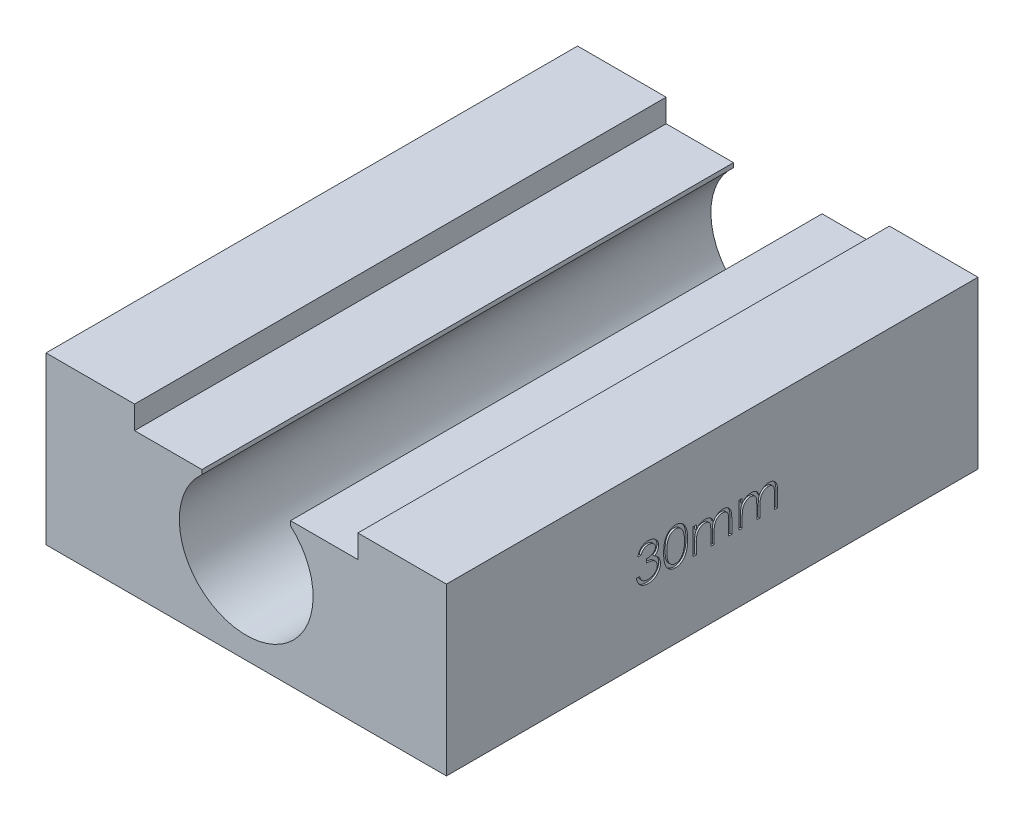
from build123d import *

# Parameters (mm, degrees)
BOSS_EXTRUDE1_DEPTH = 120
CUT_EXTRUDE1_DEPTH  = 0.4


with BuildPart() as part:
    # Sketch1 → Boss-Extrude1 (new body)
    with BuildSketch(Plane.XY):
        with BuildLine():
            Line((-25.2, 17.514150432), (-45.2, 17.514150432))
            Line((-45.2, 17.514150432), (-45.2, -20))
            Line((-45.2, -20), (45.2, -20))
            Line((45.2, -20), (45.2, 17.514150432))
            Line((45.2, 17.514150432), (25.2, 17.514150432))
            Line((25.2, 17.514150432), (25.2, 12.314150432))
            Line((25.2, 12.314150432), (10, 12.314150432))
            Line((10, 12.314150432), (10, 11.314150432))
            ThreePointArc((10, 11.314150432), (13.766081505, 6.205239721), (15.1, 0))
            ThreePointArc((15.1, 0), (-6.205239721, -13.766081505), (-10, 11.314150432))
            Line((-10, 11.314150432), (-10, 12.314150432))
            Line((-10, 12.314150432), (-25.2, 12.314150432))
            Line((-25.2, 12.314150432), (-25.2, 17.514150432))
        make_face()
    extrude(amount=BOSS_EXTRUDE1_DEPTH)

    # Sketch2 → Cut-Extrude1 (cut)
    # profile 1 of 4: a face of its own
    with BuildSketch(Plane(origin=(45.2, 0, 0), x_dir=(0, 0, -1), z_dir=(1, 0, 0))):
        with BuildLine():
            Line((-76.09656967, 1.200595483), (-76.814518387, 1.200595483))
            add(Edge.make_bspline(
                [(-76.814518387, 1.200595483), (-76.795067986, 1.281126875), (-76.757044042, 1.438559159), (-76.677735302, 1.663490041), (-76.591337005, 1.876343805), (-76.48759048, 2.07313483), (-76.374427613, 2.257818036), (-76.244775678, 2.426204607), (-76.104616313, 2.582577099), (-75.949587857, 2.721350213), (-75.787008059, 2.847013595), (-75.614586071, 2.954156583), (-75.435790885, 3.046326075), (-75.249383724, 3.122258034), (-75.054809618, 3.179459231), (-74.853827621, 3.2209605), (-74.64591105, 3.247911619), (-74.5047737, 3.250541934), (-74.433108131, 3.251877534)],
                knots=[0, 0, 0, 0, 1.162005537, 2.271625781, 3.343758855, 4.383309926, 5.390229558, 6.379919256, 7.361854164, 8.333198761, 9.295911338, 10.242430842, 11.177959212, 12.116337295, 13.062827104, 14.020064771, 14.994644689, 16, 16, 16, 16], degree=3))
            add(Edge.make_bspline(
                [(-74.433108131, 3.251877534), (-74.328690435, 3.248725008), (-74.122132696, 3.242488721), (-73.818674303, 3.185541438), (-73.526041573, 3.09542685), (-73.247437578, 2.970915473), (-72.988652589, 2.817344472), (-72.758398448, 2.63456793), (-72.559796138, 2.426112384), (-72.393180417, 2.195866523), (-72.262723277, 1.949796787), (-72.166525852, 1.696539285), (-72.107962009, 1.436694779), (-72.100372165, 1.26124957), (-72.09656967, 1.173351893)],
                knots=[0, 0, 0, 0, 1.083050992, 2.142477498, 3.193116406, 4.255571735, 5.30263384, 6.308962982, 7.297363603, 8.282367274, 9.249857812, 10.179914175, 11.08814088, 12, 12, 12, 12], degree=3))
            add(Edge.make_bspline(
                [(-72.09656967, 1.173351893), (-72.099229306, 1.088764934), (-72.104433802, 0.923241381), (-72.148625129, 0.681592245), (-72.22299373, 0.453840015), (-72.32601033, 0.239025931), (-72.459362445, 0.038512011), (-72.620900038, -0.148152882), (-72.811763265, -0.321796672), (-72.956400838, -0.421269753), (-73.030864541, -0.47248144)],
                knots=[0, 0, 0, 0, 1.024540389, 2.004866551, 2.965041327, 3.920577974, 4.882998113, 5.874504559, 6.905732034, 8, 8, 8, 8], degree=3))
            add(Edge.make_bspline(
                [(-73.030864541, -0.47248144), (-72.945763388, -0.513574403), (-72.77715339, -0.594991449), (-72.547323608, -0.754661752), (-72.338688464, -0.939019118), (-72.222337107, -1.082888039), (-72.163877362, -1.155173748)],
                knots=[0, 0, 0, 0, 1.015518401, 2.012035669, 3.001164323, 4, 4, 4, 4], degree=3))
            add(Edge.make_bspline(
                [(-72.163877362, -1.155173748), (-72.125382865, -1.20787718), (-72.049024245, -1.312420989), (-71.954771597, -1.480504248), (-71.86926505, -1.65045051), (-71.802635977, -1.826814866), (-71.751038567, -2.007553183), (-71.714156208, -2.192975803), (-71.691243886, -2.38323414), (-71.687962624, -2.51194838), (-71.686313259, -2.576648107)],
                knots=[0, 0, 0, 0, 1.025084078, 2.033381695, 3.024893161, 4.013698104, 4.991890475, 5.976764909, 6.982997093, 8, 8, 8, 8], degree=3))
            add(Edge.make_bspline(
                [(-71.686313259, -2.576648107), (-71.690415004, -2.688670326), (-71.698599192, -2.912187588), (-71.771751362, -3.242415523), (-71.885153055, -3.565216671), (-72.04619748, -3.873959161), (-72.242466071, -4.162828603), (-72.475968527, -4.421288738), (-72.744051746, -4.643456976), (-73.043036086, -4.829080355), (-73.366960951, -4.977464177), (-73.713419447, -5.080452618), (-74.077419571, -5.147529188), (-74.327036251, -5.154722032), (-74.453941464, -5.158378876)],
                knots=[0, 0, 0, 0, 0.955779014, 1.907060117, 2.875433937, 3.871313158, 4.872415639, 5.851225146, 6.836215519, 7.83643374, 8.849228613, 9.86973379, 10.916971861, 12, 12, 12, 12], degree=3))
            add(Edge.make_bspline(
                [(-74.453941464, -5.158378876), (-74.539471294, -5.156394388), (-74.707765477, -5.152489579), (-74.955179187, -5.125795633), (-75.191343071, -5.077041336), (-75.416576438, -5.01143378), (-75.631079378, -4.928252656), (-75.834197333, -4.82466706), (-76.027179947, -4.702812198), (-76.208206121, -4.561249712), (-76.377254276, -4.402892364), (-76.529831931, -4.224928913), (-76.668482886, -4.030649132), (-76.789494632, -3.817796432), (-76.898379095, -3.589121559), (-76.987935567, -3.341696419), (-77.066759724, -3.077732941), (-77.103407643, -2.89378382), (-77.122210695, -2.799404517)],
                knots=[0, 0, 0, 0, 1.048658725, 2.063410685, 3.046034179, 4.001477787, 4.936774919, 5.862367409, 6.792675028, 7.730719943, 8.675894397, 9.627829632, 10.600096036, 11.597688215, 12.626045268, 13.701542398, 14.82072376, 16, 16, 16, 16], degree=3))
            Line((-77.122210695, -2.799404517), (-76.404261977, -2.799404517))
            add(Edge.make_bspline(
                [(-76.404261977, -2.799404517), (-76.385557311, -2.861002261), (-76.349175111, -2.980815225), (-76.287245287, -3.15325021), (-76.216689236, -3.31132576), (-76.140998816, -3.456201467), (-76.061505226, -3.589304101), (-75.972556825, -3.707114088), (-75.880741636, -3.814805979), (-75.811531686, -3.875479377), (-75.777659413, -3.905173748)],
                knots=[0, 0, 0, 0, 1.198163088, 2.33053128, 3.407730985, 4.417276592, 5.372219308, 6.28897303, 7.162600585, 8, 8, 8, 8], degree=3))
            add(Edge.make_bspline(
                [(-75.777659413, -3.905173748), (-75.732867238, -3.939707082), (-75.643421152, -4.008667155), (-75.497665195, -4.096670877), (-75.344374027, -4.172924649), (-75.1802262, -4.231173097), (-75.008763867, -4.280493464), (-74.827215604, -4.312768937), (-74.637183108, -4.334913328), (-74.50742822, -4.336867457), (-74.441120952, -4.337866055)],
                knots=[0, 0, 0, 0, 0.946170439, 1.889420265, 2.845303464, 3.807233317, 4.801018734, 5.828864929, 6.890507805, 8, 8, 8, 8], degree=3))
            add(Edge.make_bspline(
                [(-74.441120952, -4.337866055), (-74.366255803, -4.336458272), (-74.219863467, -4.333705473), (-74.00625236, -4.308389572), (-73.803035337, -4.271520055), (-73.612468649, -4.214576094), (-73.432056061, -4.144219863), (-73.264326576, -4.05588065), (-73.107078334, -3.952235572), (-72.962325407, -3.834431781), (-72.832164247, -3.705468364), (-72.717559645, -3.570581344), (-72.620131847, -3.430339448), (-72.541540812, -3.2839666), (-72.479482411, -3.132068934), (-72.437235095, -2.974220181), (-72.407860204, -2.811712144), (-72.405467947, -2.701245929), (-72.404261977, -2.645558363)],
                knots=[0, 0, 0, 0, 1.217147791, 2.380027433, 3.494444702, 4.572153297, 5.609568379, 6.639424714, 7.649109417, 8.668170816, 9.669597737, 10.625200337, 11.543417969, 12.441394052, 13.322311151, 14.205496177, 15.095365482, 16, 16, 16, 16], degree=3))
            add(Edge.make_bspline(
                [(-72.404261977, -2.645558363), (-72.407759809, -2.57101816), (-72.414738069, -2.422308655), (-72.468014822, -2.203525628), (-72.555646511, -1.992729257), (-72.678326537, -1.793516023), (-72.827665345, -1.608885391), (-73.002213704, -1.444150573), (-73.203421083, -1.308218937), (-73.388609355, -1.214302008), (-73.552643999, -1.150217265), (-73.69302202, -1.107531632), (-73.850179971, -1.071386133), (-74.02221734, -1.037758084), (-74.210430406, -1.009137859), (-74.414614264, -0.985270852), (-74.634810291, -0.966173615), (-74.787247241, -0.957645398), (-74.865800439, -0.953250671)],
                knots=[0, 0, 0, 0, 1.07054697, 2.135767047, 3.216561865, 4.33974944, 5.486079747, 6.621378074, 7.775625952, 8.963672916, 9.598146892, 10.304877434, 11.070270905, 11.915000392, 12.823868403, 13.805723172, 14.86925407, 16, 16, 16, 16], degree=3))
            Line((-74.865800439, -0.953250671), (-74.865800439, -0.13273785))
            add(Edge.make_bspline(
                [(-74.865800439, -0.13273785), (-74.766826346, -0.131058299), (-74.572960411, -0.12776847), (-74.289773428, -0.087978732), (-74.018977286, -0.032937297), (-73.766573305, 0.051371714), (-73.536519103, 0.149292393), (-73.336931441, 0.2632403), (-73.170606533, 0.389902584), (-73.038352655, 0.531234263), (-72.938857275, 0.682811514), (-72.86611031, 0.840792446), (-72.823138135, 1.006561728), (-72.817401754, 1.119692398), (-72.814518387, 1.176557022)],
                knots=[0, 0, 0, 0, 1.321986639, 2.589447074, 3.816329219, 5.01088745, 6.139805852, 7.153945165, 8.075214402, 8.924034688, 9.728124013, 10.488707548, 11.240355623, 12, 12, 12, 12], degree=3))
            add(Edge.make_bspline(
                [(-72.814518387, 1.176557022), (-72.815465613, 1.218334725), (-72.817350072, 1.301449484), (-72.841115278, 1.422878212), (-72.876827372, 1.54059466), (-72.925923896, 1.654098226), (-72.991638636, 1.76260171), (-73.070280891, 1.867030164), (-73.163922263, 1.966787373), (-73.271226142, 2.059770961), (-73.386453125, 2.14838636), (-73.512738325, 2.223617531), (-73.646274038, 2.287949101), (-73.787208107, 2.340999392), (-73.93599789, 2.380906336), (-74.091944308, 2.409559688), (-74.255344727, 2.427474327), (-74.366822972, 2.430053564), (-74.423492746, 2.431364714)],
                knots=[0, 0, 0, 0, 0.884392785, 1.759457502, 2.611959086, 3.489218968, 4.37281399, 5.2945488, 6.255912374, 7.266815255, 8.301784654, 9.332968512, 10.37626691, 11.440494194, 12.520033166, 13.637162961, 14.798855837, 16, 16, 16, 16], degree=3))
            add(Edge.make_bspline(
                [(-74.423492746, 2.431364714), (-74.514582273, 2.428184458), (-74.692501305, 2.421972678), (-74.948992544, 2.36756579), (-75.187436736, 2.280758742), (-75.369696545, 2.177140412), (-75.504285286, 2.074853706), (-75.600461145, 1.985522537), (-75.694908026, 1.886247512), (-75.78141243, 1.770914083), (-75.868895805, 1.647332848), (-75.948540517, 1.509221576), (-76.025934099, 1.36018296), (-76.072568499, 1.25482151), (-76.09656967, 1.200595483)],
                knots=[0, 0, 0, 0, 1.472543308, 2.876219568, 4.221790263, 5.565193594, 6.249813518, 6.953379497, 7.687249741, 8.463570142, 9.283606569, 10.136032583, 11.040678096, 12, 12, 12, 12], degree=3))
        make_face()
    # profile 2 of 4: a face of its own
    with BuildSketch(Plane(origin=(45.2, 0, 0), x_dir=(0, 0, -1), z_dir=(1, 0, 0))):
        with BuildLine():
            add(Edge.make_bspline(
                [(-70.968364541, -0.956455799), (-70.967614786, -0.828233198), (-70.966158374, -0.579158949), (-70.949956269, -0.216222624), (-70.923041201, 0.124258037), (-70.886155777, 0.44229933), (-70.841268965, 0.737983364), (-70.781347853, 1.010519951), (-70.713204304, 1.261170481), (-70.634227285, 1.490752306), (-70.545112339, 1.702358484), (-70.448119743, 1.899901801), (-70.339400213, 2.083083361), (-70.225167269, 2.254826882), (-70.10079682, 2.412321042), (-69.969828156, 2.557789984), (-69.827149581, 2.6878717), (-69.677611277, 2.806377534), (-69.519859358, 2.91026204), (-69.358390407, 3.001765443), (-69.192093022, 3.079936568), (-69.020513176, 3.141400422), (-68.845193043, 3.192168071), (-68.665519748, 3.226885666), (-68.48119663, 3.248730028), (-68.356781922, 3.250818412), (-68.293685054, 3.251877534)],
                knots=[0, 0, 0, 0, 1.646270934, 3.197905019, 4.663502075, 6.030701355, 7.308322542, 8.50163776, 9.611534131, 10.641858119, 11.616356847, 12.558055219, 13.465016945, 14.349605745, 15.204443733, 16.039544428, 16.859896111, 17.680448484, 18.487036065, 19.28249412, 20.06191084, 20.843045899, 21.620316918, 22.403196591, 23.190181807, 24, 24, 24, 24], degree=3))
            add(Edge.make_bspline(
                [(-68.293685054, 3.251877534), (-68.230061103, 3.250762528), (-68.103533083, 3.248545132), (-67.916469368, 3.227233263), (-67.733727239, 3.191870696), (-67.556085779, 3.141765611), (-67.38208581, 3.079604065), (-67.213088306, 3.001690654), (-67.048043548, 2.9109961), (-66.88957432, 2.804427238), (-66.735940913, 2.685610607), (-66.590916998, 2.551295935), (-66.454489373, 2.402839434), (-66.324945818, 2.241829459), (-66.205961596, 2.065177837), (-66.092650893, 1.875957014), (-65.991229097, 1.670857895), (-65.893549839, 1.45330254), (-65.809236727, 1.21727132), (-65.733199595, 0.964094724), (-65.671761952, 0.690782297), (-65.620586473, 0.398768022), (-65.580940996, 0.086979489), (-65.552066386, -0.243914946), (-65.53681362, -0.594132982), (-65.53394116, -0.833579495), (-65.532467105, -0.956455799)],
                knots=[0, 0, 0, 0, 0.810914788, 1.612654377, 2.396697861, 3.181598691, 3.963628158, 4.749916497, 5.551656086, 6.361998678, 7.18212741, 8.025565596, 8.878627764, 9.750805457, 10.657531673, 11.591944965, 12.560506719, 13.57287815, 14.630710178, 15.753379473, 16.941251878, 18.199788006, 19.531962791, 20.947069417, 22.433333509, 24, 24, 24, 24], degree=3))
            add(Edge.make_bspline(
                [(-65.532467105, -0.956455799), (-65.533956442, -1.07879616), (-65.536858352, -1.317171364), (-65.551895396, -1.665813593), (-65.581515125, -1.994951978), (-65.618566526, -2.305375892), (-65.669883013, -2.595793307), (-65.732980536, -2.867209189), (-65.803038417, -3.120795639), (-65.889517946, -3.354475208), (-65.984170998, -3.571507717), (-66.087154304, -3.774175485), (-66.197485335, -3.964269868), (-66.317688181, -4.14026929), (-66.445810268, -4.303420506), (-66.584593785, -4.450843643), (-66.730126551, -4.586090894), (-66.884212073, -4.706437471), (-67.045152762, -4.811774167), (-67.209630652, -4.905977254), (-67.3805641, -4.981937699), (-67.55407942, -5.04716065), (-67.732658543, -5.096990255), (-67.916078864, -5.131444781), (-68.103407403, -5.155609006), (-68.230039552, -5.157452389), (-68.293685054, -5.158378876)],
                knots=[0, 0, 0, 0, 1.561518951, 3.042555995, 4.452378317, 5.7783523, 7.031515105, 8.214008947, 9.334062868, 10.386615937, 11.391082383, 12.354592575, 13.286541444, 14.194233754, 15.072674879, 15.931287219, 16.775624067, 17.606195743, 18.42308326, 19.229000347, 20.022332153, 20.807536673, 21.593273796, 22.3848459, 23.188221202, 24, 24, 24, 24], degree=3))
            add(Edge.make_bspline(
                [(-68.293685054, -5.158378876), (-68.356780172, -5.15731292), (-68.481191428, -5.155211065), (-68.665539829, -5.133465393), (-68.844471129, -5.098504242), (-69.018868281, -5.049552005), (-69.18962603, -4.989632379), (-69.354417542, -4.911566816), (-69.515075105, -4.821660373), (-69.67117009, -4.719270838), (-69.819769315, -4.601964134), (-69.961708984, -4.472217188), (-70.093423314, -4.326792248), (-70.216015532, -4.167985567), (-70.332527734, -3.997258156), (-70.439703444, -3.812279017), (-70.538836825, -3.613781622), (-70.629450518, -3.40048354), (-70.70979032, -3.169272277), (-70.78075651, -2.917502726), (-70.83678887, -2.6429527), (-70.884749911, -2.34782729), (-70.923434215, -2.030858306), (-70.949844102, -1.69187367), (-70.966167107, -1.331084621), (-70.967618697, -1.083610851), (-70.968364541, -0.956455799)],
                knots=[0, 0, 0, 0, 0.810891512, 1.598919785, 2.382837074, 3.152667961, 3.926044502, 4.706494248, 5.493654104, 6.291793342, 7.103789334, 7.925228297, 8.761435821, 9.622817696, 10.50288917, 11.416980706, 12.369136599, 13.353924996, 14.394355917, 15.514179734, 16.714354668, 17.994756427, 19.357759367, 20.818452758, 22.365282078, 24, 24, 24, 24], degree=3))
        make_face()
        with BuildLine():
            add(Edge.make_bspline(
                [(-70.250415823, -0.953250671), (-70.250142802, -1.060104839), (-70.24961292, -1.267487799), (-70.235770175, -1.568843824), (-70.216912502, -1.849918861), (-70.192589537, -2.111069802), (-70.156468512, -2.351412688), (-70.115995854, -2.572600535), (-70.066743078, -2.773462791), (-70.008468751, -2.955377787), (-69.942093673, -3.1214328), (-69.869623127, -3.275949864), (-69.791770046, -3.42075429), (-69.704640559, -3.554545395), (-69.609748986, -3.677759484), (-69.50923868, -3.792577386), (-69.399358487, -3.894970487), (-69.247349933, -4.017774727), (-69.046672277, -4.144675604), (-68.793825522, -4.255180952), (-68.53401192, -4.324626567), (-68.357666205, -4.333458009), (-68.269646593, -4.337866055)],
                knots=[0, 0, 0, 0, 1.459021318, 2.831673884, 4.118529203, 5.306027144, 6.411944654, 7.436330062, 8.375795394, 9.233974572, 10.042671642, 10.816086306, 11.563610507, 12.285937304, 12.993564865, 13.685989202, 14.367179055, 15.041617293, 16.353048772, 17.594441528, 18.799311195, 20, 20, 20, 20], degree=3))
            add(Edge.make_bspline(
                [(-68.269646593, -4.337866055), (-68.181057629, -4.334213985), (-68.004062604, -4.326917384), (-67.745471073, -4.25652027), (-67.494430455, -4.15030418), (-67.297694592, -4.024709882), (-67.148020207, -3.905102272), (-67.040781372, -3.803125933), (-66.942353833, -3.688941093), (-66.849000519, -3.565742703), (-66.763379775, -3.431177024), (-66.685521174, -3.285891138), (-66.614473523, -3.129481589), (-66.573995703, -3.020293613), (-66.553300439, -2.964468619)],
                knots=[0, 0, 0, 0, 1.353760809, 2.704726607, 4.075137775, 5.516104923, 6.260822281, 7.007110065, 7.778089737, 8.566572457, 9.372053459, 10.217411131, 11.088608312, 12, 12, 12, 12], degree=3))
            add(Edge.make_bspline(
                [(-66.553300439, -2.964468619), (-66.529182112, -2.893086358), (-66.480211566, -2.748149754), (-66.41709894, -2.523318549), (-66.36739517, -2.287426517), (-66.322678905, -2.041883393), (-66.292157635, -1.784878362), (-66.267591204, -1.517206628), (-66.253121063, -1.238666371), (-66.251327346, -1.049420677), (-66.250415823, -0.953250671)],
                knots=[0, 0, 0, 0, 0.884706709, 1.796334032, 2.740027952, 3.714592787, 4.726048262, 5.777819803, 6.87074269, 8, 8, 8, 8], degree=3))
            add(Edge.make_bspline(
                [(-66.250415823, -0.953250671), (-66.251673399, -0.857096219), (-66.254133485, -0.668997557), (-66.263536886, -0.39352743), (-66.287819342, -0.131886833), (-66.314788756, 0.11705139), (-66.354553833, 0.351909225), (-66.39742882, 0.57465278), (-66.455031591, 0.782522551), (-66.516562505, 0.978773023), (-66.586986266, 1.161174519), (-66.664507945, 1.330577459), (-66.747300536, 1.487799687), (-66.837225657, 1.63240984), (-66.93321579, 1.765055652), (-67.037804474, 1.883077582), (-67.14684304, 1.990133509), (-67.299568036, 2.112333667), (-67.49950927, 2.236931829), (-67.748299321, 2.351596422), (-68.007203651, 2.417443948), (-68.182228689, 2.426727805), (-68.269646593, 2.431364714)],
                knots=[0, 0, 0, 0, 1.31362396, 2.569729283, 3.763502607, 4.902122613, 5.988968491, 7.01645872, 7.998833611, 8.933434873, 9.825090667, 10.667526885, 11.477055099, 12.250526234, 12.991942729, 13.710640831, 14.402115721, 15.076753259, 16.378508321, 17.609869233, 18.806226677, 20, 20, 20, 20], degree=3))
            add(Edge.make_bspline(
                [(-68.269646593, 2.431364714), (-68.358127946, 2.426721407), (-68.535251844, 2.417426335), (-68.79684717, 2.351841755), (-69.047599973, 2.237526405), (-69.247012487, 2.111920982), (-69.399843999, 1.992290556), (-69.507461584, 1.888550089), (-69.60836712, 1.775072937), (-69.701321863, 1.650725703), (-69.788383082, 1.517090577), (-69.868339682, 1.373116258), (-69.940379293, 1.21807314), (-70.006858233, 1.052092716), (-70.06531032, 0.870193414), (-70.113525093, 0.669578572), (-70.158066929, 0.449094248), (-70.189598972, 0.207449658), (-70.217630414, -0.053766692), (-70.235644923, -0.33554342), (-70.249659226, -0.637404861), (-70.250158573, -0.84586008), (-70.250415823, -0.953250671)],
                knots=[0, 0, 0, 0, 1.207732386, 2.417664972, 3.655092373, 4.956220595, 5.625982001, 6.301752483, 6.994047911, 7.697131622, 8.419323945, 9.170223765, 9.943494443, 10.752040957, 11.610060368, 12.549350801, 13.567764191, 14.679664412, 15.874934091, 17.154273443, 18.533957287, 20, 20, 20, 20], degree=3))
        make_face(mode=Mode.SUBTRACT)
    # profile 3 of 4: a face of its own
    with BuildSketch(Plane(origin=(45.2, 0, 0), x_dir=(0, 0, -1), z_dir=(1, 0, 0))):
        with BuildLine():
            Line((-64.301697875, 0.892903175), (-63.583749157, 0.892903175))
            Line((-63.583749157, 0.892903175), (-63.583749157, -0.123122466))
            add(Edge.make_bspline(
                [(-63.583749157, -0.123122466), (-63.519100128, -0.034236519), (-63.395226392, 0.136077477), (-63.192104901, 0.360512412), (-62.989188072, 0.550976766), (-62.843054628, 0.650960472), (-62.772851721, 0.698992919)],
                knots=[0, 0, 0, 0, 1.134379233, 2.173579362, 3.122582517, 4, 4, 4, 4], degree=3))
            add(Edge.make_bspline(
                [(-62.772851721, 0.698992919), (-62.677161064, 0.744719468), (-62.487451579, 0.83537367), (-62.187064779, 0.927336091), (-61.879694106, 0.983850608), (-61.672132474, 0.991579461), (-61.567723516, 0.995467278)],
                knots=[0, 0, 0, 0, 1.014936303, 2.012140481, 3.000054389, 4, 4, 4, 4], degree=3))
            add(Edge.make_bspline(
                [(-61.567723516, 0.995467278), (-61.497110952, 0.993078042), (-61.357372486, 0.988349872), (-61.150323137, 0.957584078), (-60.949503453, 0.904404254), (-60.756099957, 0.83033037), (-60.573881262, 0.740623657), (-60.406820238, 0.635367182), (-60.256822048, 0.517202438), (-60.123962502, 0.380793449), (-60.004490444, 0.222309795), (-59.894595938, 0.037477226), (-59.793052595, -0.177854571), (-59.736775318, -0.33412095), (-59.707146593, -0.416391696)],
                knots=[0, 0, 0, 0, 1.009824226, 1.998387844, 2.986035974, 3.974953746, 4.955485308, 5.885931332, 6.793869504, 7.679848016, 8.601185859, 9.625726857, 10.749998409, 12, 12, 12, 12], degree=3))
            add(Edge.make_bspline(
                [(-59.707146593, -0.416391696), (-59.67580659, -0.359878738), (-59.614133865, -0.248669172), (-59.510578123, -0.091278859), (-59.402080302, 0.055936666), (-59.287715747, 0.193094207), (-59.16788812, 0.319516448), (-59.04203349, 0.435621366), (-58.910868276, 0.541907569), (-58.728486013, 0.66607479), (-58.491200053, 0.797963205), (-58.19202722, 0.912313934), (-57.880826827, 0.98297937), (-57.669586374, 0.991277137), (-57.562915823, 0.995467278)],
                knots=[0, 0, 0, 0, 0.86119277, 1.694706429, 2.50939023, 3.298075842, 4.073795165, 4.829715201, 5.57930267, 6.321991688, 7.768977793, 9.186738141, 10.579381044, 12, 12, 12, 12], degree=3))
            add(Edge.make_bspline(
                [(-57.562915823, 0.995467278), (-57.464901051, 0.991770773), (-57.273076625, 0.984536354), (-56.993814304, 0.927728415), (-56.733375892, 0.830179508), (-56.492285432, 0.697074053), (-56.274777287, 0.529807348), (-56.085711437, 0.330792862), (-55.926236321, 0.101438295), (-55.822056573, -0.114314822), (-55.751393112, -0.304795583), (-55.707824577, -0.467095677), (-55.669333845, -0.645727798), (-55.637376713, -0.840905539), (-55.614020023, -1.053318358), (-55.59671553, -1.282618645), (-55.585003362, -1.528984615), (-55.584175768, -1.698962901), (-55.583749157, -1.786584004)],
                knots=[0, 0, 0, 0, 1.209669288, 2.367440248, 3.500751976, 4.631527125, 5.755587489, 6.87532382, 8.007944318, 9.190864318, 9.82315674, 10.514484317, 11.263564316, 12.079023757, 12.955305781, 13.901327259, 14.918167583, 16, 16, 16, 16], degree=3))
            Line((-55.583749157, -1.786584004), (-55.583749157, -4.953250671))
            Line((-55.583749157, -4.953250671), (-56.301697875, -4.953250671))
            Line((-56.301697875, -4.953250671), (-56.301697875, -1.783378876))
            add(Edge.make_bspline(
                [(-56.301697875, -1.783378876), (-56.301875893, -1.708588993), (-56.302218017, -1.564854211), (-56.308374889, -1.358562894), (-56.319975607, -1.170520935), (-56.333540495, -1.000984733), (-56.352383488, -0.849558931), (-56.376717047, -0.716547689), (-56.402494601, -0.600904691), (-56.445319723, -0.472708011), (-56.513772047, -0.331290387), (-56.618040573, -0.178779357), (-56.749400816, -0.046023242), (-56.901081173, 0.069218625), (-57.073763333, 0.162918376), (-57.2640827, 0.22983497), (-57.470857675, 0.271258692), (-57.613995477, 0.275386728), (-57.687915823, 0.27751856)],
                knots=[0, 0, 0, 0, 1.253487763, 2.409012846, 3.458416907, 4.410876679, 5.259312806, 6.014470957, 6.676830364, 7.243083969, 8.276244668, 9.299465089, 10.325150304, 11.392391894, 12.482080715, 13.603491619, 14.762376348, 16, 16, 16, 16], degree=3))
            add(Edge.make_bspline(
                [(-57.687915823, 0.27751856), (-57.778590005, 0.274281629), (-57.957796659, 0.267884222), (-58.219386342, 0.202572513), (-58.470748665, 0.104103368), (-58.704383255, -0.038599391), (-58.919303919, -0.209589937), (-59.10421724, -0.412903298), (-59.256976521, -0.64291456), (-59.360414181, -0.855821308), (-59.425761155, -1.047065751), (-59.468908391, -1.214145459), (-59.502470429, -1.404046185), (-59.533945924, -1.615491879), (-59.554489302, -1.849938005), (-59.573159867, -2.106300065), (-59.581893268, -2.385349115), (-59.583114888, -2.578781546), (-59.583749157, -2.679212209)],
                knots=[0, 0, 0, 0, 1.090531906, 2.155305635, 3.229839962, 4.33261226, 5.44038871, 6.529323825, 7.629011124, 8.757537029, 9.370236727, 10.061839251, 10.834451254, 11.692844982, 12.636905849, 13.66920014, 14.789842145, 16, 16, 16, 16], degree=3))
            Line((-59.583749157, -2.679212209), (-59.583749157, -4.953250671))
            Line((-59.583749157, -4.953250671), (-60.301697875, -4.953250671))
            Line((-60.301697875, -4.953250671), (-60.301697875, -1.98049426))
            add(Edge.make_bspline(
                [(-60.301697875, -1.98049426), (-60.301879431, -1.896623818), (-60.302228728, -1.735265515), (-60.308346024, -1.503874258), (-60.319972588, -1.293403217), (-60.333413842, -1.104097014), (-60.352751393, -0.936299691), (-60.374716563, -0.789111673), (-60.400656244, -0.662901956), (-60.443604552, -0.524471362), (-60.509237622, -0.371966396), (-60.614810793, -0.209358347), (-60.746485262, -0.067031267), (-60.900932978, 0.054474444), (-61.074660252, 0.154912115), (-61.266622311, 0.227277262), (-61.475090683, 0.269389924), (-61.618811154, 0.274757916), (-61.692723516, 0.27751856)],
                knots=[0, 0, 0, 0, 1.320475261, 2.540461679, 3.643808994, 4.639130445, 5.527981419, 6.302341397, 6.981980563, 7.553956391, 8.582137848, 9.585246428, 10.591171744, 11.620968678, 12.668337649, 13.738356861, 14.836885341, 16, 16, 16, 16], degree=3))
            add(Edge.make_bspline(
                [(-61.692723516, 0.27751856), (-61.779617713, 0.274020366), (-61.952794763, 0.267048589), (-62.207199265, 0.204295963), (-62.452880828, 0.106000935), (-62.68592014, -0.030364366), (-62.900032478, -0.199276546), (-63.087479947, -0.397939165), (-63.245062862, -0.623879813), (-63.349592725, -0.834541565), (-63.417017808, -1.020994764), (-63.461807145, -1.179511216), (-63.500297718, -1.355511784), (-63.528901196, -1.549539466), (-63.556513575, -1.760330539), (-63.569839996, -1.988935086), (-63.582803566, -2.235157001), (-63.583426228, -2.40515139), (-63.583749157, -2.493314773)],
                knots=[0, 0, 0, 0, 1.098833095, 2.189935336, 3.297829714, 4.440610912, 5.596351641, 6.740013378, 7.886572111, 9.072425424, 9.705826452, 10.395263256, 11.156850408, 11.985370555, 12.878090359, 13.847760091, 14.883794034, 16, 16, 16, 16], degree=3))
            Line((-63.583749157, -2.493314773), (-63.583749157, -4.953250671))
            Line((-63.583749157, -4.953250671), (-64.301697875, -4.953250671))
            Line((-64.301697875, -4.953250671), (-64.301697875, 0.892903175))
        make_face()
    # profile 4 of 4: a face of its own
    with BuildSketch(Plane(origin=(45.2, 0, 0), x_dir=(0, 0, -1), z_dir=(1, 0, 0))):
        with BuildLine():
            Line((-53.942723516, 0.892903175), (-53.224774798, 0.892903175))
            Line((-53.224774798, 0.892903175), (-53.224774798, -0.123122466))
            add(Edge.make_bspline(
                [(-53.224774798, -0.123122466), (-53.160125769, -0.034236519), (-53.036252033, 0.136077477), (-52.833130542, 0.360512412), (-52.630213713, 0.550976766), (-52.484080269, 0.650960472), (-52.413877362, 0.698992919)],
                knots=[0, 0, 0, 0, 1.134379233, 2.173579362, 3.122582517, 4, 4, 4, 4], degree=3))
            add(Edge.make_bspline(
                [(-52.413877362, 0.698992919), (-52.318186705, 0.744719468), (-52.12847722, 0.83537367), (-51.828090421, 0.927336091), (-51.520719747, 0.983850608), (-51.313158115, 0.991579461), (-51.208749157, 0.995467278)],
                knots=[0, 0, 0, 0, 1.014936303, 2.012140481, 3.000054389, 4, 4, 4, 4], degree=3))
            add(Edge.make_bspline(
                [(-51.208749157, 0.995467278), (-51.138136593, 0.993078042), (-50.998398127, 0.988349872), (-50.791348778, 0.957584078), (-50.590529094, 0.904404254), (-50.397125598, 0.83033037), (-50.214906903, 0.740623657), (-50.047845879, 0.635367182), (-49.897847689, 0.517202438), (-49.764988143, 0.380793449), (-49.645516085, 0.222309795), (-49.535621579, 0.037477226), (-49.434078236, -0.177854571), (-49.377800959, -0.33412095), (-49.348172234, -0.416391696)],
                knots=[0, 0, 0, 0, 1.009824226, 1.998387844, 2.986035974, 3.974953746, 4.955485308, 5.885931332, 6.793869504, 7.679848016, 8.601185859, 9.625726857, 10.749998409, 12, 12, 12, 12], degree=3))
            add(Edge.make_bspline(
                [(-49.348172234, -0.416391696), (-49.316832231, -0.359878738), (-49.255159506, -0.248669172), (-49.151603764, -0.091278859), (-49.043105943, 0.055936666), (-48.928741388, 0.193094207), (-48.808913761, 0.319516448), (-48.683059131, 0.435621366), (-48.551893917, 0.541907569), (-48.369511654, 0.66607479), (-48.132225694, 0.797963205), (-47.833052861, 0.912313934), (-47.521852469, 0.98297937), (-47.310612015, 0.991277137), (-47.203941464, 0.995467278)],
                knots=[0, 0, 0, 0, 0.86119277, 1.694706429, 2.50939023, 3.298075842, 4.073795165, 4.829715201, 5.57930267, 6.321991688, 7.768977793, 9.186738141, 10.579381044, 12, 12, 12, 12], degree=3))
            add(Edge.make_bspline(
                [(-47.203941464, 0.995467278), (-47.105926692, 0.991770773), (-46.914102267, 0.984536354), (-46.634839945, 0.927728415), (-46.374401533, 0.830179508), (-46.133311073, 0.697074053), (-45.915802928, 0.529807348), (-45.726737078, 0.330792862), (-45.567261962, 0.101438295), (-45.463082214, -0.114314822), (-45.392418753, -0.304795583), (-45.348850218, -0.467095677), (-45.310359486, -0.645727798), (-45.278402354, -0.840905539), (-45.255045664, -1.053318358), (-45.237741171, -1.282618645), (-45.226029003, -1.528984615), (-45.225201409, -1.698962901), (-45.224774798, -1.786584004)],
                knots=[0, 0, 0, 0, 1.209669288, 2.367440248, 3.500751976, 4.631527125, 5.755587489, 6.87532382, 8.007944318, 9.190864318, 9.82315674, 10.514484317, 11.263564316, 12.079023757, 12.955305781, 13.901327259, 14.918167583, 16, 16, 16, 16], degree=3))
            Line((-45.224774798, -1.786584004), (-45.224774798, -4.953250671))
            Line((-45.224774798, -4.953250671), (-45.942723516, -4.953250671))
            Line((-45.942723516, -4.953250671), (-45.942723516, -1.783378876))
            add(Edge.make_bspline(
                [(-45.942723516, -1.783378876), (-45.942901534, -1.708588993), (-45.943243658, -1.564854211), (-45.94940053, -1.358562894), (-45.961001248, -1.170520935), (-45.974566136, -1.000984733), (-45.993409129, -0.849558931), (-46.017742688, -0.716547689), (-46.043520242, -0.600904691), (-46.086345364, -0.472708011), (-46.154797688, -0.331290387), (-46.259066214, -0.178779357), (-46.390426457, -0.046023242), (-46.542106814, 0.069218625), (-46.714788974, 0.162918376), (-46.905108341, 0.22983497), (-47.111883316, 0.271258692), (-47.255021118, 0.275386728), (-47.328941464, 0.27751856)],
                knots=[0, 0, 0, 0, 1.253487763, 2.409012846, 3.458416907, 4.410876679, 5.259312806, 6.014470957, 6.676830364, 7.243083969, 8.276244668, 9.299465089, 10.325150304, 11.392391894, 12.482080715, 13.603491619, 14.762376348, 16, 16, 16, 16], degree=3))
            add(Edge.make_bspline(
                [(-47.328941464, 0.27751856), (-47.419615646, 0.274281629), (-47.5988223, 0.267884222), (-47.860411983, 0.202572513), (-48.111774306, 0.104103368), (-48.345408896, -0.038599391), (-48.56032956, -0.209589937), (-48.745242881, -0.412903298), (-48.898002162, -0.64291456), (-49.001439822, -0.855821308), (-49.066786796, -1.047065751), (-49.109934032, -1.214145459), (-49.14349607, -1.404046185), (-49.174971565, -1.615491879), (-49.195514943, -1.849938005), (-49.214185508, -2.106300065), (-49.222918909, -2.385349115), (-49.224140529, -2.578781546), (-49.224774798, -2.679212209)],
                knots=[0, 0, 0, 0, 1.090531906, 2.155305635, 3.229839962, 4.33261226, 5.44038871, 6.529323825, 7.629011124, 8.757537029, 9.370236727, 10.061839251, 10.834451254, 11.692844982, 12.636905849, 13.66920014, 14.789842145, 16, 16, 16, 16], degree=3))
            Line((-49.224774798, -2.679212209), (-49.224774798, -4.953250671))
            Line((-49.224774798, -4.953250671), (-49.942723516, -4.953250671))
            Line((-49.942723516, -4.953250671), (-49.942723516, -1.98049426))
            add(Edge.make_bspline(
                [(-49.942723516, -1.98049426), (-49.942905072, -1.896623818), (-49.943254369, -1.735265515), (-49.949371665, -1.503874258), (-49.960998229, -1.293403217), (-49.974439483, -1.104097014), (-49.993777034, -0.936299691), (-50.015742204, -0.789111673), (-50.041681885, -0.662901956), (-50.084630193, -0.524471362), (-50.150263263, -0.371966396), (-50.255836434, -0.209358347), (-50.387510903, -0.067031267), (-50.541958619, 0.054474444), (-50.715685893, 0.154912115), (-50.907647952, 0.227277262), (-51.116116324, 0.269389924), (-51.259836795, 0.274757916), (-51.333749157, 0.27751856)],
                knots=[0, 0, 0, 0, 1.320475261, 2.540461679, 3.643808994, 4.639130445, 5.527981419, 6.302341397, 6.981980563, 7.553956391, 8.582137848, 9.585246428, 10.591171744, 11.620968678, 12.668337649, 13.738356861, 14.836885341, 16, 16, 16, 16], degree=3))
            add(Edge.make_bspline(
                [(-51.333749157, 0.27751856), (-51.420643354, 0.274020366), (-51.593820404, 0.267048589), (-51.848224906, 0.204295963), (-52.093906469, 0.106000935), (-52.326945781, -0.030364366), (-52.54105812, -0.199276546), (-52.728505588, -0.397939165), (-52.886088503, -0.623879813), (-52.990618366, -0.834541565), (-53.058043449, -1.020994764), (-53.102832786, -1.179511216), (-53.141323359, -1.355511784), (-53.169926837, -1.549539466), (-53.197539216, -1.760330539), (-53.210865637, -1.988935086), (-53.223829207, -2.235157001), (-53.224451869, -2.40515139), (-53.224774798, -2.493314773)],
                knots=[0, 0, 0, 0, 1.098833095, 2.189935336, 3.297829714, 4.440610912, 5.596351641, 6.740013378, 7.886572111, 9.072425424, 9.705826452, 10.395263256, 11.156850408, 11.985370555, 12.878090359, 13.847760091, 14.883794034, 16, 16, 16, 16], degree=3))
            Line((-53.224774798, -2.493314773), (-53.224774798, -4.953250671))
            Line((-53.224774798, -4.953250671), (-53.942723516, -4.953250671))
            Line((-53.942723516, -4.953250671), (-53.942723516, 0.892903175))
        make_face()
    extrude(amount=-CUT_EXTRUDE1_DEPTH, mode=Mode.SUBTRACT)


solid = part.part
